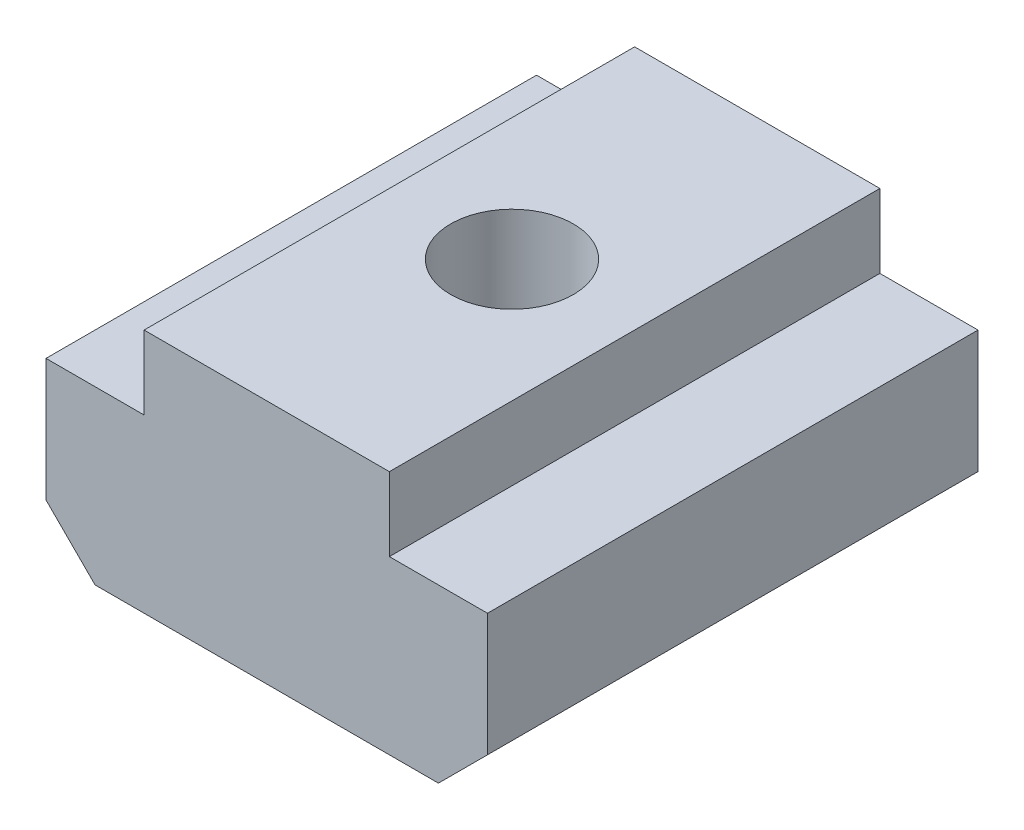
from build123d import *

# Parameters (mm, degrees)
BOSS_EXTRUDE1_DEPTH   = 10
M3X0_5_TAPPED_HOLE1_D = 2.5


with BuildPart() as part:
    # Sketch1 → Boss-Extrude1 (new body)
    with BuildSketch(Plane.XY):
        Polygon((-3.5, 0), (3.5, 0), (4.5, 1), (4.5, 3.5), (2.5, 3.5), (2.5, 5), (-2.5, 5), (-2.5, 3.5), (-4.5, 3.5), (-4.5, 1), align=None)
    extrude(amount=BOSS_EXTRUDE1_DEPTH)

    # M3x0.5 Tapped Hole1 (through all)
    with Locations(Plane(origin=(0, 5, 0), x_dir=(1, 0, 0), z_dir=(0, 1, 0))):
        with Locations((0, -5)):
            Hole(M3X0_5_TAPPED_HOLE1_D / 2)


solid = part.part
